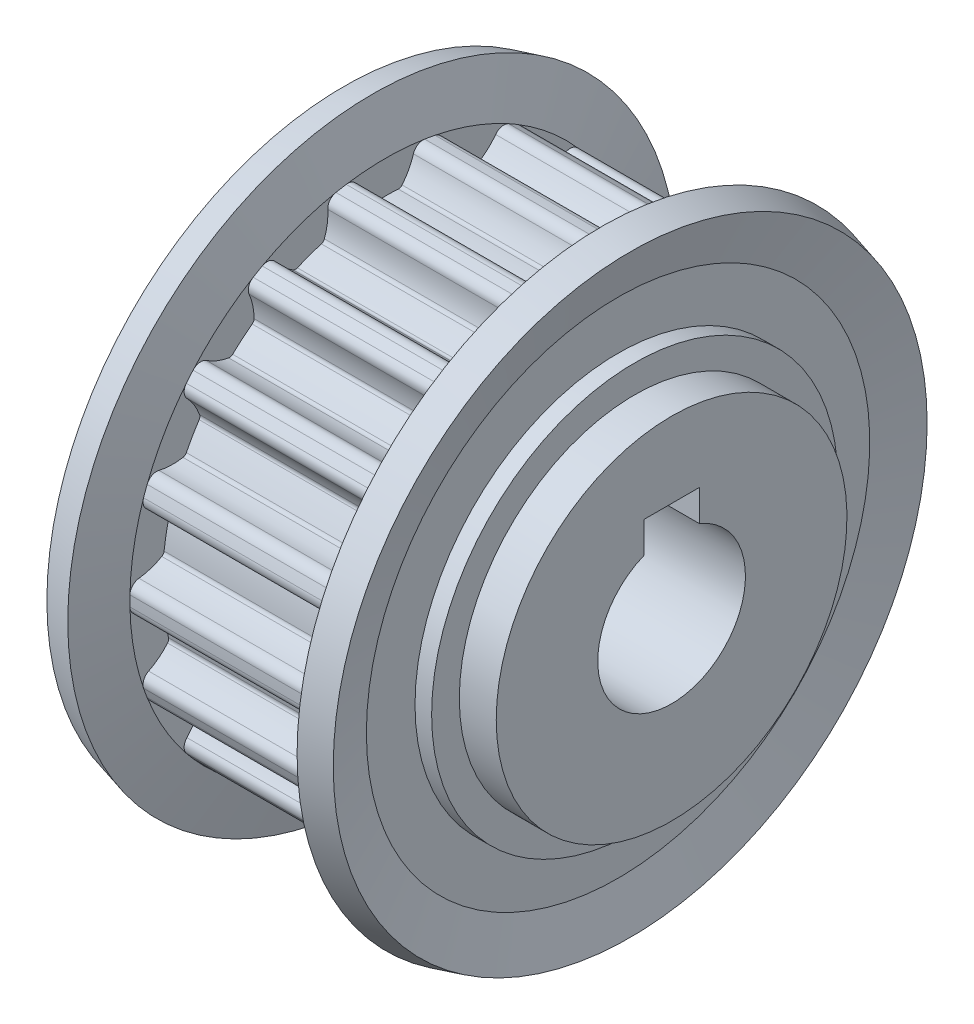
from build123d import *

# Parameters (mm, degrees)
SKETCH_2_W           = 25
SKETCH_2_H           = 4
CUT_EXTRUDE_1_DEPTH  = 11
CUT_EXTRUDE_2_DEPTH  = 11
CUT_EXTRUDE_3_DEPTH  = 11
CUT_EXTRUDE_4_DEPTH  = 11
CUT_EXTRUDE_5_DEPTH  = 11
CUT_EXTRUDE_6_DEPTH  = 11
CUT_EXTRUDE_7_DEPTH  = 11
CUT_EXTRUDE_8_DEPTH  = 11
CUT_EXTRUDE_9_DEPTH  = 11
CUT_EXTRUDE_10_DEPTH = 11
CUT_EXTRUDE_11_DEPTH = 11
CUT_EXTRUDE_12_DEPTH = 11
CUT_EXTRUDE_13_DEPTH = 11
CUT_EXTRUDE_14_DEPTH = 11
CUT_EXTRUDE_15_DEPTH = 11
CUT_EXTRUDE_16_DEPTH = 11
CUT_EXTRUDE_17_DEPTH = 11
CUT_EXTRUDE_18_DEPTH = 11
SKETCH_21_W          = 3
SKETCH_21_H          = 5.4
CUT_EXTRUDE_19_DEPTH = 25
SKETCH_22_W          = 1.621
SKETCH_22_H          = 9.5
SKETCH_24_W          = 7
SKETCH_24_H          = 9.5


with BuildPart() as part:
    # 스케치1 → 회전1 (revolve)
    with BuildSketch(Plane.XY, mode=Mode.PRIVATE) as revolve_1_sk:
        Polygon((0, 0), (0, 11), (0.9, 11), (0.9, 13.634356004), (0.243113572, 16.085889528), (1.788594894, 16.5), (2.5, 13.845), (13.5, 13.845), (14.211405106, 16.5), (15.756886428, 16.085889528), (15.1, 13.634356004), (15.1, 11), (16, 11), (16, 9.5), (25, 9.5), (25, 0), align=None)
    revolve(revolve_1_sk.sketch.rotate(Axis((25, 0, 0), (-1, 0, 0)), 270), axis=Axis((25, 0, 0), (-1, 0, 0)))

    # 스케치2 → 컷-회전1 (revolve, cut)
    with BuildSketch(Plane.XY, mode=Mode.PRIVATE) as cut_revolve_1_sk:
        with Locations((12.5, 2)):
            Rectangle(SKETCH_2_W, SKETCH_2_H)
    revolve(cut_revolve_1_sk.sketch.rotate(Axis((25, 0, 0), (-1, 0, 0)), 270), axis=Axis((25, 0, 0), (-1, 0, 0)), mode=Mode.SUBTRACT)

    # 스케치3 → 컷-돌출1 (cut)
    with BuildSketch(Plane(origin=(2.5, 0, 0), x_dir=(0, 0, -1), z_dir=(1, 0, 0))):
        with BuildLine():
            Line((2.1243151, 13.681056624), (2.1243151, 14.166612522))
            ThreePointArc((2.1243151, 14.166612522), (0, 14.325), (-2.1243151, 14.166612522))
            Line((-2.1243151, 14.166612522), (-2.1243151, 13.681056624))
            ThreePointArc((-2.1243151, 13.681056624), (-1.746277471, 13.602618612), (-1.512942792, 13.295015136))
            ThreePointArc((-1.512942792, 13.295015136), (-1.263642967, 12.689365371), (-0.89881438, 12.145433258))
            ThreePointArc((-0.89881438, 12.145433258), (-0.806096067, 12.075598583), (-0.691833137, 12.055164533))
            ThreePointArc((-0.691833137, 12.055164533), (-6e-09, 12.075), (0.691833126, 12.055164533))
            ThreePointArc((0.691833126, 12.055164533), (0.806096062, 12.07559858), (0.89881438, 12.145433258))
            ThreePointArc((0.89881438, 12.145433258), (1.263642967, 12.689365371), (1.512942792, 13.295015136))
            ThreePointArc((1.512942792, 13.295015136), (1.746277471, 13.602618612), (2.1243151, 13.681056624))
        make_face()
    extrude(amount=CUT_EXTRUDE_1_DEPTH, mode=Mode.SUBTRACT)

    # 스케치4 → 컷-돌출2 (cut)
    with BuildSketch(Plane(origin=(2.5, 0, 0), x_dir=(0, 0, -1), z_dir=(1, 0, 0))):
        with BuildLine():
            Line((6.675400171, 12.1294294), (6.841470069, 12.585702694))
            ThreePointArc((6.841470069, 12.585702694), (4.899438553, 13.461096793), (2.849063622, 14.038819804))
            Line((2.849063622, 14.038819804), (2.682993724, 13.582546509))
            ThreePointArc((2.682993724, 13.582546509), (3.011405514, 13.379542404), (3.125461805, 13.010684527))
            ThreePointArc((3.125461805, 13.010684527), (3.152582591, 12.35629435), (3.309373584, 11.720386632))
            ThreePointArc((3.309373584, 11.720386632), (3.372615432, 11.623051972), (3.472998607, 11.564770023))
            ThreePointArc((3.472998607, 11.564770023), (4.129893225, 11.346788398), (4.773219585, 11.091528289))
            ThreePointArc((4.773219585, 11.091528289), (4.887580478, 11.071649787), (4.998592064, 11.105561386))
            ThreePointArc((4.998592064, 11.105561386), (5.527454534, 11.491911653), (5.96886416, 11.975770706))
            ThreePointArc((5.96886416, 11.975770706), (6.29333362, 12.185018263), (6.675400171, 12.1294294))
        make_face()
    extrude(amount=CUT_EXTRUDE_2_DEPTH, mode=Mode.SUBTRACT)

    # 스케치5 → 컷-돌출3 (cut)
    with BuildSketch(Plane(origin=(2.5, 0, 0), x_dir=(0, 0, -1), z_dir=(1, 0, 0))):
        with BuildLine():
            Line((10.421333463, 9.114813978), (10.733442778, 9.486771375))
            ThreePointArc((10.733442778, 9.486771375), (9.207932509, 10.973586648), (7.478803223, 12.217738226))
            Line((7.478803223, 12.217738226), (7.166693908, 11.845780828))
            ThreePointArc((7.166693908, 11.845780828), (7.405868551, 11.542695921), (7.386889582, 11.157073347))
            ThreePointArc((7.386889582, 11.157073347), (7.188560162, 10.532871871), (7.118402252, 9.881688403))
            ThreePointArc((7.118402252, 9.881688403), (7.144539736, 9.768593756), (7.218935464, 9.67949357))
            ThreePointArc((7.218935464, 9.67949357), (7.761660383, 9.249986654), (8.278885317, 8.79009004))
            ThreePointArc((8.278885317, 8.79009004), (8.379550556, 8.732296629), (8.495465774, 8.72619491))
            ThreePointArc((8.495465774, 8.72619491), (9.124573508, 8.908363787), (9.704852419, 9.212071586))
            ThreePointArc((9.704852419, 9.212071586), (10.081320856, 9.297724879), (10.421333463, 9.114813978))
        make_face()
    extrude(amount=CUT_EXTRUDE_3_DEPTH, mode=Mode.SUBTRACT)

    # 스케치6 → 컷-돌출4 (cut)
    with BuildSketch(Plane(origin=(2.5, 0, 0), x_dir=(0, 0, -1), z_dir=(1, 0, 0))):
        with BuildLine():
            Line((12.910300137, 5.00081747), (13.33080388, 5.243595419))
            ThreePointArc((13.33080388, 5.243595419), (12.405813909, 7.1625), (11.20648878, 8.923017103))
            Line((11.20648878, 8.923017103), (10.785985037, 8.680239154))
            ThreePointArc((10.785985037, 8.680239154), (10.907074541, 8.313629958), (10.757349456, 7.95775446))
            ThreePointArc((10.757349456, 7.95775446), (10.357491286, 7.439029596), (10.068846552, 6.851112715))
            ThreePointArc((10.068846552, 6.851112715), (10.054727105, 6.735898963), (10.094162163, 6.626727338))
            ThreePointArc((10.094162163, 6.626727338), (10.457256748, 6.037500005), (10.785995296, 5.428437204))
            ThreePointArc((10.785995296, 5.428437204), (10.860823167, 5.339699623), (10.967660932, 5.294320543))
            ThreePointArc((10.967660932, 5.294320543), (11.621134253, 5.250335775), (12.270292248, 5.337260676))
            ThreePointArc((12.270292248, 5.337260676), (12.653352012, 5.288988655), (12.910300137, 5.00081747))
        make_face()
    extrude(amount=CUT_EXTRUDE_4_DEPTH, mode=Mode.SUBTRACT)

    # 스케치7 → 컷-돌출5 (cut)
    with BuildSketch(Plane(origin=(2.5, 0, 0), x_dir=(0, 0, -1), z_dir=(1, 0, 0))):
        with BuildLine():
            Line((13.842094079, 0.283648571), (14.320273292, 0.367964468))
            ThreePointArc((14.320273292, 0.367964468), (14.107371062, 2.487510145), (13.5825064, 4.552048428))
            Line((13.5825064, 4.552048428), (13.104327187, 4.467732531))
            ThreePointArc((13.104327187, 4.467732531), (13.09272637, 4.081817526), (12.830314224, 3.798612942))
            ThreePointArc((12.830314224, 3.798612942), (12.2771561, 3.447930563), (11.804839357, 2.994191722))
            ThreePointArc((11.804839357, 2.994191722), (11.752165994, 2.890755344), (11.751883932, 2.77467999))
            ThreePointArc((11.751883932, 2.77467999), (11.891553617, 2.096801751), (11.992155058, 1.412034726))
            ThreePointArc((11.992155058, 1.412034726), (12.032120216, 1.303056037), (12.116994316, 1.223872983))
            ThreePointArc((12.116994316, 1.223872983), (12.716014696, 0.959039781), (13.355753741, 0.818697359))
            ThreePointArc((13.355753741, 0.818697359), (13.699202171, 0.642322342), (13.842094079, 0.283648571))
        make_face()
    extrude(amount=CUT_EXTRUDE_5_DEPTH, mode=Mode.SUBTRACT)

    # 스케치8 → 컷-돌출6 (cut)
    with BuildSketch(Plane(origin=(2.5, 0, 0), x_dir=(0, 0, -1), z_dir=(1, 0, 0))):
        with BuildLine():
            Line((13.104327187, -4.467732531), (13.5825064, -4.552048428))
            ThreePointArc((13.5825064, -4.552048428), (14.107371062, -2.487510145), (14.320273292, -0.367964468))
            Line((14.320273292, -0.367964468), (13.842094079, -0.283648571))
            ThreePointArc((13.842094079, -0.283648571), (13.699202171, -0.642322342), (13.355753741, -0.818697359))
            ThreePointArc((13.355753741, -0.818697359), (12.716014696, -0.959039781), (12.116994316, -1.223872983))
            ThreePointArc((12.116994316, -1.223872983), (12.03212022, -1.303056032), (11.992155059, -1.412034715))
            ThreePointArc((11.992155059, -1.412034715), (11.891553619, -2.09680174), (11.751883935, -2.774679979))
            ThreePointArc((11.751883935, -2.774679979), (11.752165992, -2.890755339), (11.804839357, -2.994191722))
            ThreePointArc((11.804839357, -2.994191722), (12.2771561, -3.447930563), (12.830314224, -3.798612942))
            ThreePointArc((12.830314224, -3.798612942), (13.09272637, -4.081817526), (13.104327187, -4.467732531))
        make_face()
    extrude(amount=CUT_EXTRUDE_6_DEPTH, mode=Mode.SUBTRACT)

    # 스케치9 → 컷-돌출7 (cut)
    with BuildSketch(Plane(origin=(2.5, 0, 0), x_dir=(0, 0, -1), z_dir=(1, 0, 0))):
        with BuildLine():
            Line((10.785985037, -8.680239154), (11.20648878, -8.923017103))
            ThreePointArc((11.20648878, -8.923017103), (12.405813909, -7.1625), (13.33080388, -5.243595419))
            Line((13.33080388, -5.243595419), (12.910300137, -5.00081747))
            ThreePointArc((12.910300137, -5.00081747), (12.653352012, -5.288988655), (12.270292248, -5.337260676))
            ThreePointArc((12.270292248, -5.337260676), (11.621134253, -5.250335775), (10.967660932, -5.294320543))
            ThreePointArc((10.967660932, -5.294320543), (10.860823172, -5.33969962), (10.785995301, -5.428437194))
            ThreePointArc((10.785995301, -5.428437194), (10.457256753, -6.037499995), (10.09416217, -6.626727329))
            ThreePointArc((10.09416217, -6.626727329), (10.054727106, -6.735898958), (10.068846552, -6.851112715))
            ThreePointArc((10.068846552, -6.851112715), (10.357491286, -7.439029596), (10.757349456, -7.95775446))
            ThreePointArc((10.757349456, -7.95775446), (10.907074541, -8.313629958), (10.785985037, -8.680239154))
        make_face()
    extrude(amount=CUT_EXTRUDE_7_DEPTH, mode=Mode.SUBTRACT)

    # 스케치10 → 컷-돌출8 (cut)
    with BuildSketch(Plane(origin=(2.5, 0, 0), x_dir=(0, 0, -1), z_dir=(1, 0, 0))):
        with BuildLine():
            Line((7.166693908, -11.845780828), (7.478803223, -12.217738226))
            ThreePointArc((7.478803223, -12.217738226), (9.207932509, -10.973586648), (10.733442778, -9.486771375))
            Line((10.733442778, -9.486771375), (10.421333463, -9.114813978))
            ThreePointArc((10.421333463, -9.114813978), (10.081320856, -9.297724879), (9.704852419, -9.212071586))
            ThreePointArc((9.704852419, -9.212071586), (9.124573508, -8.908363787), (8.495465774, -8.72619491))
            ThreePointArc((8.495465774, -8.72619491), (8.379550561, -8.732296628), (8.278885325, -8.790090033))
            ThreePointArc((8.278885325, -8.790090033), (7.761660391, -9.249986647), (7.218935473, -9.679493563))
            ThreePointArc((7.218935473, -9.679493563), (7.144539738, -9.768593751), (7.118402252, -9.881688403))
            ThreePointArc((7.118402252, -9.881688403), (7.188560162, -10.532871871), (7.386889582, -11.157073347))
            ThreePointArc((7.386889582, -11.157073347), (7.405868551, -11.542695921), (7.166693908, -11.845780828))
        make_face()
    extrude(amount=CUT_EXTRUDE_8_DEPTH, mode=Mode.SUBTRACT)

    # 스케치11 → 컷-돌출9 (cut)
    with BuildSketch(Plane(origin=(2.5, 0, 0), x_dir=(0, 0, -1), z_dir=(1, 0, 0))):
        with BuildLine():
            Line((2.682993724, -13.582546509), (2.849063622, -14.038819804))
            ThreePointArc((2.849063622, -14.038819804), (4.899438553, -13.461096793), (6.841470069, -12.585702694))
            Line((6.841470069, -12.585702694), (6.675400171, -12.1294294))
            ThreePointArc((6.675400171, -12.1294294), (6.29333362, -12.185018263), (5.96886416, -11.975770706))
            ThreePointArc((5.96886416, -11.975770706), (5.527454534, -11.491911653), (4.998592064, -11.105561386))
            ThreePointArc((4.998592064, -11.105561386), (4.887580484, -11.071649787), (4.773219595, -11.091528285))
            ThreePointArc((4.773219595, -11.091528285), (4.129893236, -11.346788394), (3.472998618, -11.564770019))
            ThreePointArc((3.472998618, -11.564770019), (3.372615436, -11.623051968), (3.309373584, -11.720386632))
            ThreePointArc((3.309373584, -11.720386632), (3.152582591, -12.35629435), (3.125461805, -13.010684527))
            ThreePointArc((3.125461805, -13.010684527), (3.011405514, -13.379542404), (2.682993724, -13.582546509))
        make_face()
    extrude(amount=CUT_EXTRUDE_9_DEPTH, mode=Mode.SUBTRACT)

    # 스케치12 → 컷-돌출10 (cut)
    with BuildSketch(Plane(origin=(2.5, 0, 0), x_dir=(0, 0, -1), z_dir=(1, 0, 0))):
        with BuildLine():
            Line((-2.1243151, -13.681056624), (-2.1243151, -14.166612522))
            ThreePointArc((-2.1243151, -14.166612522), (0, -14.325), (2.1243151, -14.166612522))
            Line((2.1243151, -14.166612522), (2.1243151, -13.681056624))
            ThreePointArc((2.1243151, -13.681056624), (1.746277471, -13.602618612), (1.512942792, -13.295015136))
            ThreePointArc((1.512942792, -13.295015136), (1.263642967, -12.689365371), (0.89881438, -12.145433258))
            ThreePointArc((0.89881438, -12.145433258), (0.806096067, -12.075598583), (0.691833137, -12.055164533))
            ThreePointArc((0.691833137, -12.055164533), (6e-09, -12.075), (-0.691833126, -12.055164533))
            ThreePointArc((-0.691833126, -12.055164533), (-0.806096062, -12.07559858), (-0.89881438, -12.145433258))
            ThreePointArc((-0.89881438, -12.145433258), (-1.263642967, -12.689365371), (-1.512942792, -13.295015136))
            ThreePointArc((-1.512942792, -13.295015136), (-1.746277471, -13.602618612), (-2.1243151, -13.681056624))
        make_face()
    extrude(amount=CUT_EXTRUDE_10_DEPTH, mode=Mode.SUBTRACT)

    # 스케치13 → 컷-돌출11 (cut)
    with BuildSketch(Plane(origin=(2.5, 0, 0), x_dir=(0, 0, -1), z_dir=(1, 0, 0))):
        with BuildLine():
            Line((-6.675400171, -12.1294294), (-6.841470069, -12.585702694))
            ThreePointArc((-6.841470069, -12.585702694), (-4.899438553, -13.461096793), (-2.849063622, -14.038819804))
            Line((-2.849063622, -14.038819804), (-2.682993724, -13.582546509))
            ThreePointArc((-2.682993724, -13.582546509), (-3.011405514, -13.379542404), (-3.125461805, -13.010684527))
            ThreePointArc((-3.125461805, -13.010684527), (-3.152582591, -12.35629435), (-3.309373584, -11.720386632))
            ThreePointArc((-3.309373584, -11.720386632), (-3.372615432, -11.623051972), (-3.472998607, -11.564770023))
            ThreePointArc((-3.472998607, -11.564770023), (-4.129893225, -11.346788398), (-4.773219585, -11.091528289))
            ThreePointArc((-4.773219585, -11.091528289), (-4.887580478, -11.071649787), (-4.998592064, -11.105561386))
            ThreePointArc((-4.998592064, -11.105561386), (-5.527454534, -11.491911653), (-5.96886416, -11.975770706))
            ThreePointArc((-5.96886416, -11.975770706), (-6.29333362, -12.185018263), (-6.675400171, -12.1294294))
        make_face()
    extrude(amount=CUT_EXTRUDE_11_DEPTH, mode=Mode.SUBTRACT)

    # 스케치14 → 컷-돌출12 (cut)
    with BuildSketch(Plane(origin=(2.5, 0, 0), x_dir=(0, 0, -1), z_dir=(1, 0, 0))):
        with BuildLine():
            Line((-10.421333463, -9.114813978), (-10.733442778, -9.486771375))
            ThreePointArc((-10.733442778, -9.486771375), (-9.207932509, -10.973586648), (-7.478803223, -12.217738226))
            Line((-7.478803223, -12.217738226), (-7.166693908, -11.845780828))
            ThreePointArc((-7.166693908, -11.845780828), (-7.405868551, -11.542695921), (-7.386889582, -11.157073347))
            ThreePointArc((-7.386889582, -11.157073347), (-7.188560162, -10.532871871), (-7.118402252, -9.881688403))
            ThreePointArc((-7.118402252, -9.881688403), (-7.144539736, -9.768593756), (-7.218935464, -9.67949357))
            ThreePointArc((-7.218935464, -9.67949357), (-7.761660383, -9.249986654), (-8.278885317, -8.79009004))
            ThreePointArc((-8.278885317, -8.79009004), (-8.379550556, -8.732296629), (-8.495465774, -8.72619491))
            ThreePointArc((-8.495465774, -8.72619491), (-9.124573508, -8.908363787), (-9.704852419, -9.212071586))
            ThreePointArc((-9.704852419, -9.212071586), (-10.081320856, -9.297724879), (-10.421333463, -9.114813978))
        make_face()
    extrude(amount=CUT_EXTRUDE_12_DEPTH, mode=Mode.SUBTRACT)

    # 스케치15 → 컷-돌출13 (cut)
    with BuildSketch(Plane(origin=(2.5, 0, 0), x_dir=(0, 0, -1), z_dir=(1, 0, 0))):
        with BuildLine():
            Line((-12.910300137, -5.00081747), (-13.33080388, -5.243595419))
            ThreePointArc((-13.33080388, -5.243595419), (-12.405813909, -7.1625), (-11.20648878, -8.923017103))
            Line((-11.20648878, -8.923017103), (-10.785985037, -8.680239154))
            ThreePointArc((-10.785985037, -8.680239154), (-10.907074541, -8.313629958), (-10.757349456, -7.95775446))
            ThreePointArc((-10.757349456, -7.95775446), (-10.357491286, -7.439029596), (-10.068846552, -6.851112715))
            ThreePointArc((-10.068846552, -6.851112715), (-10.054727105, -6.735898963), (-10.094162163, -6.626727338))
            ThreePointArc((-10.094162163, -6.626727338), (-10.457256748, -6.037500005), (-10.785995296, -5.428437204))
            ThreePointArc((-10.785995296, -5.428437204), (-10.860823167, -5.339699623), (-10.967660932, -5.294320543))
            ThreePointArc((-10.967660932, -5.294320543), (-11.621134253, -5.250335775), (-12.270292248, -5.337260676))
            ThreePointArc((-12.270292248, -5.337260676), (-12.653352012, -5.288988655), (-12.910300137, -5.00081747))
        make_face()
    extrude(amount=CUT_EXTRUDE_13_DEPTH, mode=Mode.SUBTRACT)

    # 스케치16 → 컷-돌출14 (cut)
    with BuildSketch(Plane(origin=(2.5, 0, 0), x_dir=(0, 0, -1), z_dir=(1, 0, 0))):
        with BuildLine():
            Line((-13.842094079, -0.283648571), (-14.320273292, -0.367964468))
            ThreePointArc((-14.320273292, -0.367964468), (-14.107371062, -2.487510145), (-13.5825064, -4.552048428))
            Line((-13.5825064, -4.552048428), (-13.104327187, -4.467732531))
            ThreePointArc((-13.104327187, -4.467732531), (-13.09272637, -4.081817526), (-12.830314224, -3.798612942))
            ThreePointArc((-12.830314224, -3.798612942), (-12.2771561, -3.447930563), (-11.804839357, -2.994191722))
            ThreePointArc((-11.804839357, -2.994191722), (-11.752165994, -2.890755344), (-11.751883932, -2.77467999))
            ThreePointArc((-11.751883932, -2.77467999), (-11.891553617, -2.096801751), (-11.992155058, -1.412034726))
            ThreePointArc((-11.992155058, -1.412034726), (-12.032120216, -1.303056037), (-12.116994316, -1.223872983))
            ThreePointArc((-12.116994316, -1.223872983), (-12.716014696, -0.959039781), (-13.355753741, -0.818697359))
            ThreePointArc((-13.355753741, -0.818697359), (-13.699202171, -0.642322342), (-13.842094079, -0.283648571))
        make_face()
    extrude(amount=CUT_EXTRUDE_14_DEPTH, mode=Mode.SUBTRACT)

    # 스케치17 → 컷-돌출15 (cut)
    with BuildSketch(Plane(origin=(2.5, 0, 0), x_dir=(0, 0, -1), z_dir=(1, 0, 0))):
        with BuildLine():
            Line((-13.104327187, 4.467732531), (-13.5825064, 4.552048428))
            ThreePointArc((-13.5825064, 4.552048428), (-14.107371062, 2.487510145), (-14.320273292, 0.367964468))
            Line((-14.320273292, 0.367964468), (-13.842094079, 0.283648571))
            ThreePointArc((-13.842094079, 0.283648571), (-13.699202171, 0.642322342), (-13.355753741, 0.818697359))
            ThreePointArc((-13.355753741, 0.818697359), (-12.716014696, 0.959039781), (-12.116994316, 1.223872983))
            ThreePointArc((-12.116994316, 1.223872983), (-12.03212022, 1.303056032), (-11.992155059, 1.412034715))
            ThreePointArc((-11.992155059, 1.412034715), (-11.891553619, 2.09680174), (-11.751883935, 2.774679979))
            ThreePointArc((-11.751883935, 2.774679979), (-11.752165992, 2.890755339), (-11.804839357, 2.994191722))
            ThreePointArc((-11.804839357, 2.994191722), (-12.2771561, 3.447930563), (-12.830314224, 3.798612942))
            ThreePointArc((-12.830314224, 3.798612942), (-13.09272637, 4.081817526), (-13.104327187, 4.467732531))
        make_face()
    extrude(amount=CUT_EXTRUDE_15_DEPTH, mode=Mode.SUBTRACT)

    # 스케치18 → 컷-돌출16 (cut)
    with BuildSketch(Plane(origin=(2.5, 0, 0), x_dir=(0, 0, -1), z_dir=(1, 0, 0))):
        with BuildLine():
            Line((-10.785985037, 8.680239154), (-11.20648878, 8.923017103))
            ThreePointArc((-11.20648878, 8.923017103), (-12.405813909, 7.1625), (-13.33080388, 5.243595419))
            Line((-13.33080388, 5.243595419), (-12.910300137, 5.00081747))
            ThreePointArc((-12.910300137, 5.00081747), (-12.653352012, 5.288988655), (-12.270292248, 5.337260676))
            ThreePointArc((-12.270292248, 5.337260676), (-11.621134253, 5.250335775), (-10.967660932, 5.294320543))
            ThreePointArc((-10.967660932, 5.294320543), (-10.860823172, 5.33969962), (-10.785995301, 5.428437194))
            ThreePointArc((-10.785995301, 5.428437194), (-10.457256753, 6.037499995), (-10.09416217, 6.626727329))
            ThreePointArc((-10.09416217, 6.626727329), (-10.054727106, 6.735898958), (-10.068846552, 6.851112715))
            ThreePointArc((-10.068846552, 6.851112715), (-10.357491286, 7.439029596), (-10.757349456, 7.95775446))
            ThreePointArc((-10.757349456, 7.95775446), (-10.907074541, 8.313629958), (-10.785985037, 8.680239154))
        make_face()
    extrude(amount=CUT_EXTRUDE_16_DEPTH, mode=Mode.SUBTRACT)

    # 스케치19 → 컷-돌출17 (cut)
    with BuildSketch(Plane(origin=(2.5, 0, 0), x_dir=(0, 0, -1), z_dir=(1, 0, 0))):
        with BuildLine():
            Line((-7.166693908, 11.845780828), (-7.478803223, 12.217738226))
            ThreePointArc((-7.478803223, 12.217738226), (-9.207932509, 10.973586648), (-10.733442778, 9.486771375))
            Line((-10.733442778, 9.486771375), (-10.421333463, 9.114813978))
            ThreePointArc((-10.421333463, 9.114813978), (-10.081320856, 9.297724879), (-9.704852419, 9.212071586))
            ThreePointArc((-9.704852419, 9.212071586), (-9.124573508, 8.908363787), (-8.495465774, 8.72619491))
            ThreePointArc((-8.495465774, 8.72619491), (-8.379550561, 8.732296628), (-8.278885325, 8.790090033))
            ThreePointArc((-8.278885325, 8.790090033), (-7.761660391, 9.249986647), (-7.218935473, 9.679493563))
            ThreePointArc((-7.218935473, 9.679493563), (-7.144539738, 9.768593751), (-7.118402252, 9.881688403))
            ThreePointArc((-7.118402252, 9.881688403), (-7.188560162, 10.532871871), (-7.386889582, 11.157073347))
            ThreePointArc((-7.386889582, 11.157073347), (-7.405868551, 11.542695921), (-7.166693908, 11.845780828))
        make_face()
    extrude(amount=CUT_EXTRUDE_17_DEPTH, mode=Mode.SUBTRACT)

    # 스케치20 → 컷-돌출18 (cut)
    with BuildSketch(Plane(origin=(2.5, 0, 0), x_dir=(0, 0, -1), z_dir=(1, 0, 0))):
        with BuildLine():
            Line((-2.682993724, 13.582546509), (-2.849063622, 14.038819804))
            ThreePointArc((-2.849063622, 14.038819804), (-4.899438553, 13.461096793), (-6.841470069, 12.585702694))
            Line((-6.841470069, 12.585702694), (-6.675400171, 12.1294294))
            ThreePointArc((-6.675400171, 12.1294294), (-6.29333362, 12.185018263), (-5.96886416, 11.975770706))
            ThreePointArc((-5.96886416, 11.975770706), (-5.527454534, 11.491911653), (-4.998592064, 11.105561386))
            ThreePointArc((-4.998592064, 11.105561386), (-4.887580484, 11.071649787), (-4.773219595, 11.091528285))
            ThreePointArc((-4.773219595, 11.091528285), (-4.129893236, 11.346788394), (-3.472998618, 11.564770019))
            ThreePointArc((-3.472998618, 11.564770019), (-3.372615436, 11.623051968), (-3.309373584, 11.720386632))
            ThreePointArc((-3.309373584, 11.720386632), (-3.152582591, 12.35629435), (-3.125461805, 13.010684527))
            ThreePointArc((-3.125461805, 13.010684527), (-3.011405514, 13.379542404), (-2.682993724, 13.582546509))
        make_face()
    extrude(amount=CUT_EXTRUDE_18_DEPTH, mode=Mode.SUBTRACT)

    # 스케치21 → 컷-돌출19 (cut)
    with BuildSketch(Plane(origin=(0, 0, 0), x_dir=(0, 0, -1), z_dir=(1, 0, 0))):
        with Locations((0, 2.7)):
            Rectangle(SKETCH_21_W, SKETCH_21_H)
    extrude(amount=CUT_EXTRUDE_19_DEPTH, mode=Mode.SUBTRACT)

    # 스케치22 → 컷-회전2 (revolve, cut)
    with BuildSketch(Plane(origin=(20.5, 0, 0), x_dir=(0, 0, -1), z_dir=(1, 0, 0)), mode=Mode.PRIVATE) as cut_revolve_2_sk:
        with Locations((0.8105, 4.75)):
            Rectangle(SKETCH_22_W, SKETCH_22_H)
    revolve(cut_revolve_2_sk.sketch.rotate(Axis((20.5, 0, 0), (0, 1, 0)), 180), axis=Axis((20.5, 0, 0), (0, 1, 0)), mode=Mode.SUBTRACT)

    # 스케치23 → 컷-회전3 (revolve, cut)
    with BuildSketch(Plane(origin=(20.5, 0, 0), x_dir=(0, 0, -1), z_dir=(1, 0, 0)), mode=Mode.PRIVATE) as cut_revolve_3_sk:
        Polygon((8.227241336, -4.75), (7.416741336, -6.15382718), (-0.8105, -1.40382718), (0, 0), align=None)
    revolve(cut_revolve_3_sk.sketch.rotate(Axis((20.5, 0, 0), (0, -0.49999999999999856, -0.8660254037844396)), 180), axis=Axis((20.5, 0, 0), (0, -0.49999999999999856, -0.8660254037844396)), mode=Mode.SUBTRACT)

    # 스케치24 → 컷-회전4 (revolve, cut)
    with BuildSketch(Plane.XY, mode=Mode.PRIVATE) as cut_revolve_4_sk:
        with Locations((21.5, 4.75)):
            Rectangle(SKETCH_24_W, SKETCH_24_H)
    revolve(cut_revolve_4_sk.sketch.rotate(Axis((25, 0, 0), (-1, 0, 0)), 270), axis=Axis((25, 0, 0), (-1, 0, 0)), mode=Mode.SUBTRACT)


solid = part.part
